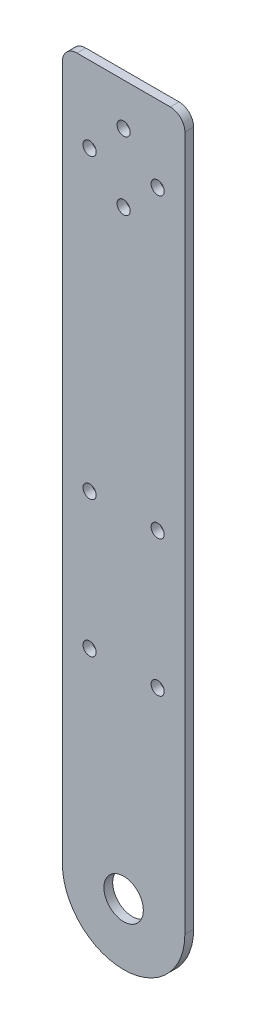
from build123d import *

# Parameters (mm, degrees)
ESBO_O1_R                = 1.35
ESBO_O1_R_2              = 4.05
RESSALTO_EXTRUS_O1_DEPTH = 1.8
FILETE1_R                = 3
FILETE3_R                = 3


with BuildPart() as part:
    # Esboço1 → Ressalto-extrusão1 (new body)
    with BuildSketch(Plane.XY):
        with BuildLine():
            Line((-12.596174938, 0), (-12.596174938, 145.832394841))
            Line((-12.596174938, 145.832394841), (12.596174938, 145.832394841))
            Line((12.596174938, 145.832394841), (12.596174938, 0))
            ThreePointArc((12.596174938, 0), (0, -12.596174938), (-12.596174938, 0))
        make_face()
        with Locations((7, 41.089981595)):
            Circle(ESBO_O1_R, mode=Mode.SUBTRACT)
        with Locations((7, 69.089981595)):
            Circle(ESBO_O1_R, mode=Mode.SUBTRACT)
        with Locations(Location((-7, 41.089981595, 0), (0, 0, 180))):
            Circle(ESBO_O1_R, mode=Mode.SUBTRACT)
        with Locations(Location((-7, 69.089981595, 0), (0, 0, 180))):
            Circle(ESBO_O1_R, mode=Mode.SUBTRACT)
        with Locations((7, 130.185826181)):
            Circle(ESBO_O1_R, mode=Mode.SUBTRACT)
        with Locations((0, 137.185826181)):
            Circle(ESBO_O1_R, mode=Mode.SUBTRACT)
        with Locations(Location((-7, 130.185826181, 0), (0, 0, 180))):
            Circle(ESBO_O1_R, mode=Mode.SUBTRACT)
        with Locations(Location((0, 123.185826181, 0), (0, 0, 180))):
            Circle(ESBO_O1_R, mode=Mode.SUBTRACT)
        Circle(ESBO_O1_R_2, mode=Mode.SUBTRACT)
    extrude(amount=RESSALTO_EXTRUS_O1_DEPTH)

    # Filete1
    filete1_edges = [part.edges().sort_by_distance(p)[0] for p in [
        (12.596174938, 145.832394841, 0.9),
    ]]
    fillet(filete1_edges, radius=FILETE1_R)

    # Filete3
    filete3_edges = [part.edges().sort_by_distance(p)[0] for p in [
        (-12.596174938, 145.832394841, 0.9),
    ]]
    fillet(filete3_edges, radius=FILETE3_R)


solid = part.part
